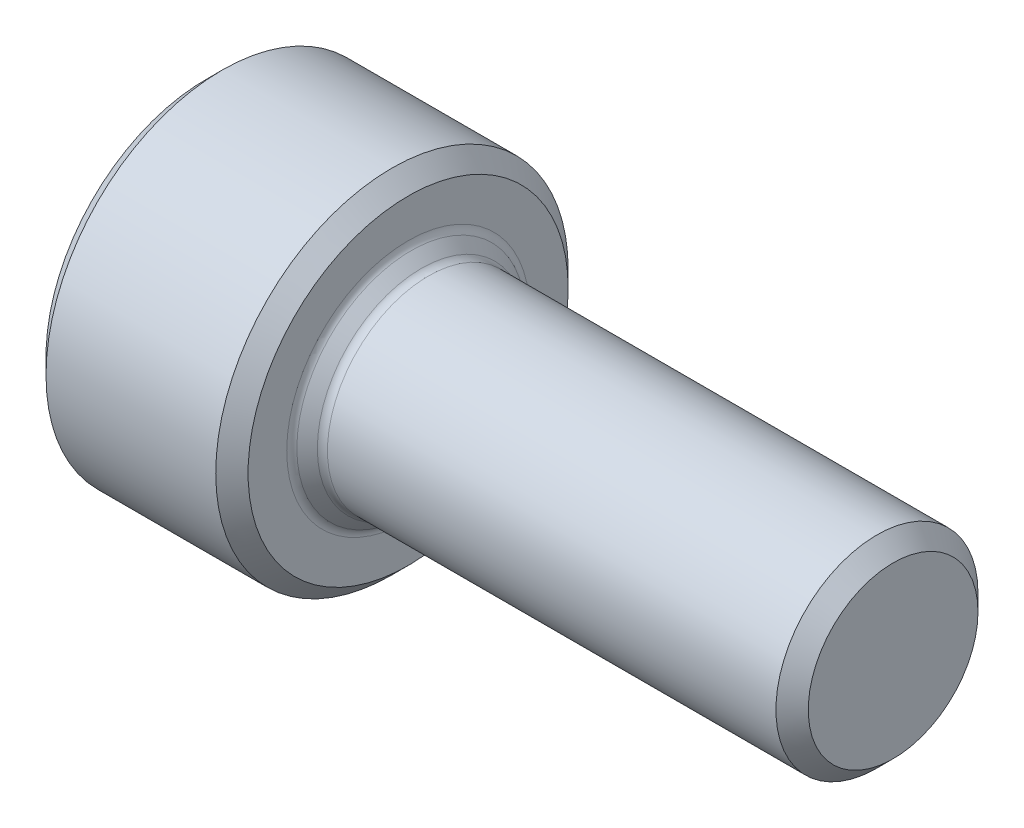
from build123d import *

# Parameters (mm, degrees)
SKETCH_1_R                  = 4.36
EXTRUDE_1_DEPTH             = 5
HOLE_WIZARD_1_5_1_5_1_D     = 4
HOLE_WIZARD_1_5_1_5_1_DEPTH = 2.5
HOLE_WIZARD_1_5_1_5_1_TIP   = 1.154700538
CUT_EXTRUDE_1_DEPTH         = 2.5
SKETCH_4_R                  = 2.5
EXTRUDE_2_DEPTH             = 12
CHAMFER_1_SIZE              = 0.4
FILLET_1_R                  = 0.25


with BuildPart() as part:
    # 草圖1 → 伸長1 (new body)
    with BuildSketch(Plane(origin=(0, 0, 0), x_dir=(0, 0, -1), z_dir=(1, 0, 0))):
        Circle(SKETCH_1_R)
    extrude(amount=-EXTRUDE_1_DEPTH)

    # Ø1.5 (1.5) 直徑孔1
    with Locations(Plane(origin=(-5, 0, 0), x_dir=(0, 0, -1), z_dir=(-1, 0, 0))):
        with Locations((0, 0)):
            Hole(HOLE_WIZARD_1_5_1_5_1_D / 2, depth=HOLE_WIZARD_1_5_1_5_1_DEPTH)
            with Locations((0, 0, -(HOLE_WIZARD_1_5_1_5_1_DEPTH + HOLE_WIZARD_1_5_1_5_1_TIP / 2))):  # 120° drill point
                Cone(0, HOLE_WIZARD_1_5_1_5_1_D / 2, HOLE_WIZARD_1_5_1_5_1_TIP, mode=Mode.SUBTRACT)

    # 草圖3 → 除料-伸長1 (cut)
    with BuildSketch(Plane.ZY.offset(5)):
        Polygon((2.29, 0), (1.145, 1.983198175), (-1.145, 1.983198175), (-2.29, 0), (-1.145, -1.983198175), (1.145, -1.983198175), align=None)
    extrude(amount=-CUT_EXTRUDE_1_DEPTH, mode=Mode.SUBTRACT)

    # 草圖4 → 伸長2 (add)
    with BuildSketch(Plane(origin=(0, 0, 0), x_dir=(0, 0, -1), z_dir=(1, 0, 0))):
        Circle(SKETCH_4_R)
    extrude(amount=EXTRUDE_2_DEPTH)

    # 導角1
    chamfer_1_edges = [part.edges().sort_by_distance(p)[0] for p in [
        (0, 0, 4.36),
        (-5, 0, 4.36),
        (0, 0, 2.5),
        (12, 0, 2.5),
    ]]
    chamfer(chamfer_1_edges, length=CHAMFER_1_SIZE)

    # 圓角1
    fillet_1_edges = [part.edges().sort_by_distance(p)[0] for p in [
        (0.4, 0, 2.5),
        (0, 0, 2.9),
    ]]
    fillet(fillet_1_edges, radius=FILLET_1_R)


solid = part.part
